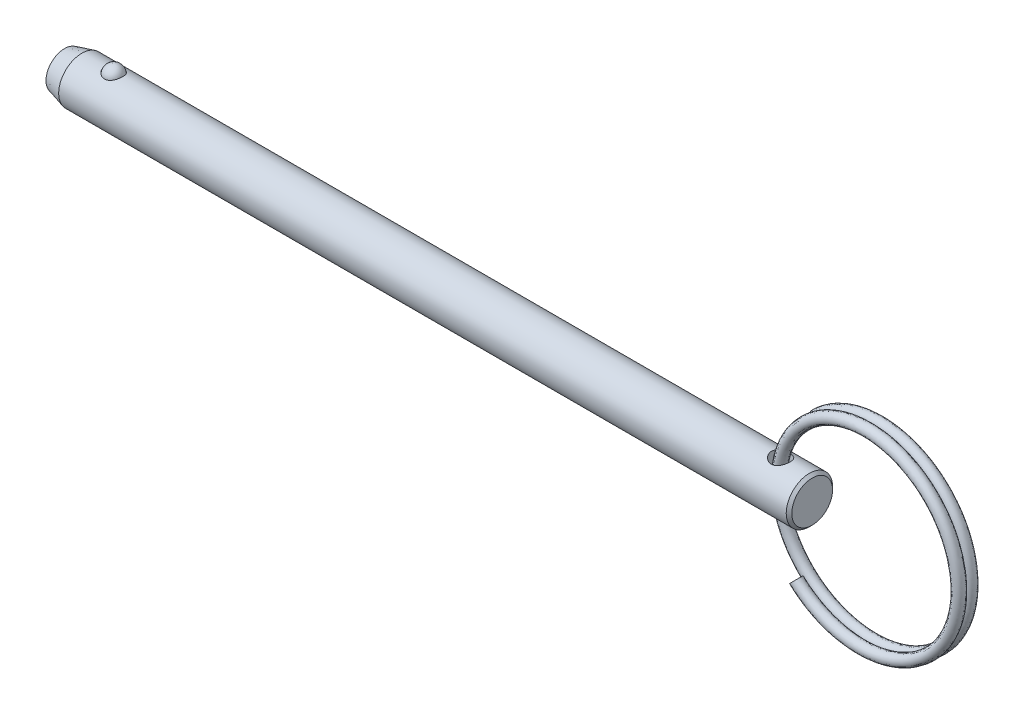
from build123d import *

# Parameters (mm, degrees)
SKETCH4_W          = 1.27
SKETCH4_H          = 6.35
SWEEP1_PITCH       = 1.5494
SWEEP1_HEIGHT      = 1.355725
SWEEP1_RADIUS      = 13.462
SKETCH6_R          = 0.762
SWEEP2_PITCH       = 1.5494
SWEEP2_HEIGHT      = 1.355725
SWEEP2_RADIUS      = 13.462
SWEEP2_START_ANGLE = -180
SKETCH6_2_R        = 0.762


with BuildPart() as part:
    # Sketch1 → Revolve1 (revolve)
    with BuildSketch(Plane.XY, mode=Mode.PRIVATE) as revolve1_sk:
        Polygon((51.2064, 2.794), (50.8254, 3.175), (-48.836547737, 3.175), (-51.2064, 2.54), (-51.2064, 0), (51.2064, 0), align=None)
    revolve(revolve1_sk.sketch.rotate(Axis((51.2064, 0, 0), (1, 0, 0)), 90), axis=Axis((51.2064, 0, 0), (1, 0, 0)))

    # Sketch2 → Cut-Revolve1 (revolve, cut)
    with BuildSketch(Plane.XY):
        with BuildLine():
            Line((-43.214582051, 2.8575), (-45.729182051, 2.8575))
            ThreePointArc((-45.729182051, 2.8575), (-44.471882051, 4.1148), (-43.214582051, 2.8575))
        make_face()
    revolve(axis=Axis((-43.214582051, 2.8575, 0), (1, 0, 0)), mode=Mode.SUBTRACT)

    # Sketch4 → Cut-Revolve2 (revolve, cut)
    with BuildSketch(Plane.XY, mode=Mode.PRIVATE) as cut_revolve2_sk:
        with Locations((47.5234, 0)):
            Rectangle(SKETCH4_W, SKETCH4_H)
    revolve(cut_revolve2_sk.sketch.rotate(Axis((46.8884, -3.175, 0), (0, 1, 0)), 90), axis=Axis((46.8884, -3.175, 0), (0, 1, 0)), mode=Mode.SUBTRACT)


with BuildPart() as body_2:
    # Sketch3 → Revolve2 (revolve)
    with BuildSketch(Plane.XY):
        with BuildLine():
            Line((-43.239982051, 2.8575), (-45.703782051, 2.8575))
            ThreePointArc((-45.703782051, 2.8575), (-44.471882051, 4.0894), (-43.239982051, 2.8575))
        make_face()
    revolve(axis=Axis((-43.239982051, 2.8575, 0), (1, 0, 0)))


with BuildPart() as body_3:
    # Sweep1: sweep along a helix
    with BuildLine() as sweep1_path:
        Helix(SWEEP1_PITCH, SWEEP1_HEIGHT, SWEEP1_RADIUS, center=(59.373425091, 0, 0), direction=(0, 0, -1), lefthand=True)
    # Sketch6 → Sweep1 (sweep)
    with BuildSketch(Plane(origin=(114.003847968, 0, 0), x_dir=(0, 0, -1), z_dir=(0, 1, 0))):
        with Locations((0, 67.330422877)):
            Circle(SKETCH6_R)
    sweep(path=sweep1_path.line, is_frenet=True)

    # Sweep2: sweep along a helix
    with BuildLine() as sweep2_path:
        add(Helix(SWEEP2_PITCH, SWEEP2_HEIGHT, SWEEP2_RADIUS, center=(59.373425091, 0, 0), direction=(0, 0, 1), lefthand=True, mode=Mode.PRIVATE).rotate(Axis((59.373425091, 0, 0), (0, 0, 1)), SWEEP2_START_ANGLE))
    # Sketch6<2> → Sweep2 (sweep)
    with BuildSketch(Plane(origin=(114.003847968, 0, 0), x_dir=(0, 0, -1), z_dir=(0, 1, 0))):
        with Locations((0, 67.330422877)):
            Circle(SKETCH6_2_R)
    sweep(path=sweep2_path.line, is_frenet=True)


solid = Compound([part.part, body_2.part, body_3.part])
